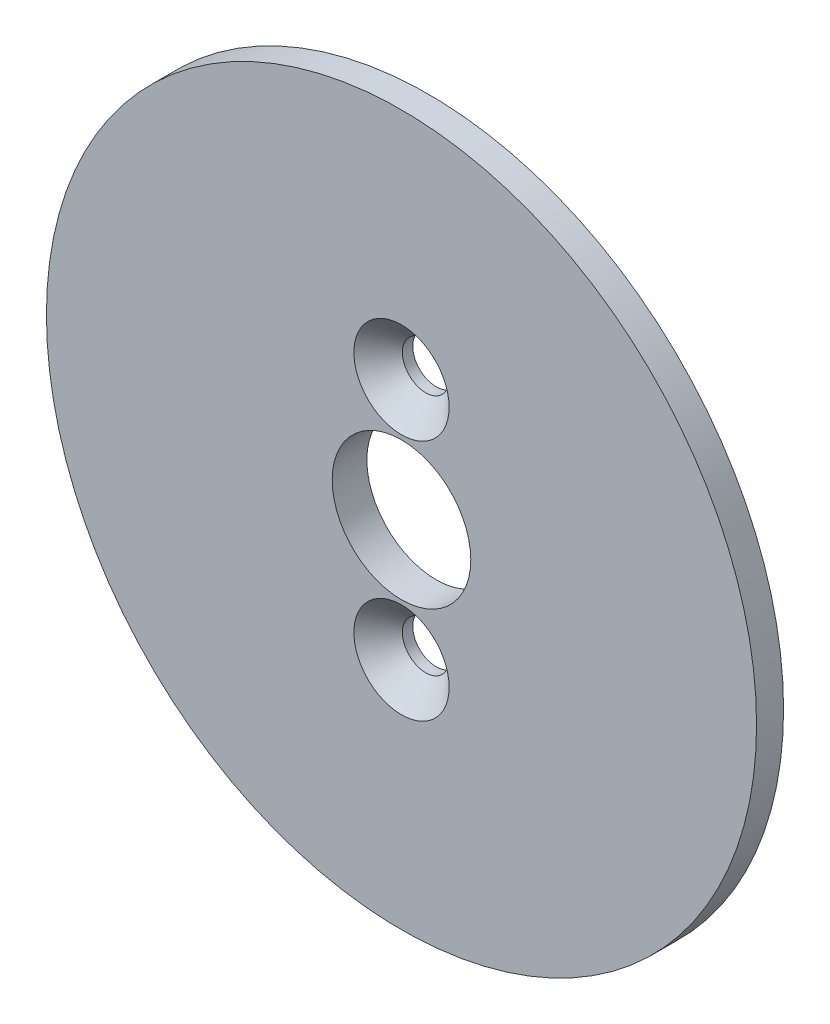
from build123d import *

# Parameters (mm, degrees)
SKETCH1_R                                    = 20.5
BOSS_EXTRUDE1_DEPTH                          = 2
CUT_EXTRUDE1_REACH                           = 31.06
SKETCH3_R                                    = 4
CSK_FOR_M3_FLAT_COUNTERSUNK_HEAD_SCR_2_COUNT = 2
CSK_FOR_M3_FLAT_COUNTERSUNK_HEAD_SCR_2_PITCH = 14


with BuildPart() as part:
    # Sketch1 → Boss-Extrude1 (new body)
    with BuildSketch(Plane.XY):
        Circle(SKETCH1_R)
    extrude(amount=BOSS_EXTRUDE1_DEPTH)

    # Sketch2 → Cut-Revolve1 (revolve, cut)
    with BuildSketch(Plane(origin=(0, 0, 2), x_dir=(0, 0, 1), z_dir=(-1, 0, 0)), mode=Mode.PRIVATE) as cut_revolve1_sk:
        Polygon((-2, 18), (-1.558933629, 20.501411693), (-2, 20.501411693), align=None)
    revolve(cut_revolve1_sk.sketch.rotate(Axis((0, 0, -0.1), (0, 0, 1)), 270), axis=Axis((0, 0, -0.1), (0, 0, 1)), mode=Mode.SUBTRACT)

    # Sketch3 → Cut-Extrude1 (cut, up to next)
    with BuildSketch(Plane(origin=(0, 0, 0), x_dir=(-1, 0, 0), z_dir=(0, 0, -1)), mode=Mode.PRIVATE) as cut_extrude1_sk1:
        Circle(SKETCH3_R)
    cut_extrude1_tool1 = extrude(cut_extrude1_sk1.sketch, amount=-CUT_EXTRUDE1_REACH, mode=Mode.PRIVATE) & part.part
    add(cut_extrude1_tool1.solids().sort_by_distance((0, 0, 0))[0], mode=Mode.SUBTRACT)

    # Sketch5 → CSK for M3 Flat Countersunk Head Screw1 (revolve, cut)
    with BuildSketch(Plane(origin=(0, 7, 2), x_dir=(0, -1, 0), z_dir=(1, 0, 0))):
        Polygon((0, 0), (0, 2), (1.35, 2), (1.35, 1.4), (2.75, 0), align=None)
    csk_for_m3_flat_countersunk_head_screw1 = revolve(axis=Axis((0, 7, 8.35), (0, 0, -1)), mode=Mode.SUBTRACT)

    # CSK for M3 Flat Countersunk Head Scr 2: CSK for M3 Flat Countersunk Head Screw1 ×2
    with Locations(*[(0, -i * CSK_FOR_M3_FLAT_COUNTERSUNK_HEAD_SCR_2_PITCH, 0) for i in range(1, CSK_FOR_M3_FLAT_COUNTERSUNK_HEAD_SCR_2_COUNT)]):
        add(csk_for_m3_flat_countersunk_head_screw1, mode=Mode.SUBTRACT)


solid = part.part
